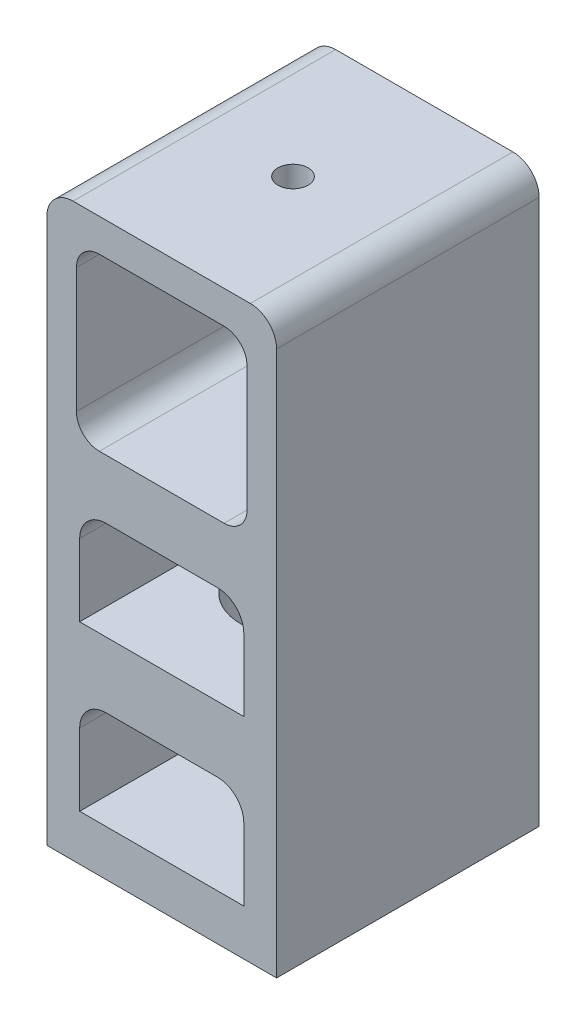
from build123d import *

# Parameters (mm, degrees)
SKETCH1_W           = 35
SKETCH1_H           = 35
SKETCH1_W_2         = 26
SKETCH1_H_2         = 26
SKETCH1_H_3         = 30
SKETCH1_W_3         = 25
SKETCH1_H_4         = 15
BOSS_EXTRUDE2_DEPTH = 40
FILLET3_R           = 3.5
FILLET4_R           = 4
SKETCH6_R           = 2.3
CUT_EXTRUDE5_DEPTH  = 5
BOSS_EXTRUDE3_DEPTH = 40
SKETCH7_R           = 8
CUT_EXTRUDE8_DEPTH  = 10
SKETCH11_R          = 6.25
CUT_EXTRUDE9_DEPTH  = 4
SKETCH12_R          = 2.75
CUT_EXTRUDE10_DEPTH = 97.046863561
FILLET5_R           = 4


with BuildPart() as part:
    # Sketch1 → Boss-Extrude2 (new body)
    # profile 1 of 2: a face of its own
    with BuildSketch(Plane.XY):
        with Locations((17.5, 17.5)):
            Rectangle(SKETCH1_W, SKETCH1_H)
        with Locations((17.5, 17)):
            Rectangle(SKETCH1_W_2, SKETCH1_H_2, mode=Mode.SUBTRACT)
    # profile 2 of 2: a face of its own
    with BuildSketch(Plane.XY):
        with Locations((17.5, -15)):
            Rectangle(SKETCH1_W, SKETCH1_H_3)
        with Locations((17.5, -12.5)):
            Rectangle(SKETCH1_W_3, SKETCH1_H_4, mode=Mode.SUBTRACT)
    extrude(amount=BOSS_EXTRUDE2_DEPTH)

    # Fillet3
    fillet3_edges = [part.edges().sort_by_distance(p)[0] for p in [
        (4.5, 30, 20),
        (4.5, 4, 20),
        (30.5, 4, 20),
        (30.5, 30, 20),
    ]]
    fillet(fillet3_edges, radius=FILLET3_R)

    # Fillet4
    fillet4_edges = [part.edges().sort_by_distance(p)[0] for p in [
        (0, 35, 20),
        (35, 35, 20),
    ]]
    fillet(fillet4_edges, radius=FILLET4_R)

    # Sketch6 → Cut-Extrude5 (cut)
    with BuildSketch(Plane(origin=(0, 35, 0), x_dir=(1, 0, 0), z_dir=(0, 1, 0))):
        with Locations(Location((17.5, -20, 0), (0, 0, 270))):
            Circle(SKETCH6_R)
    extrude(amount=-CUT_EXTRUDE5_DEPTH, mode=Mode.SUBTRACT)

    # Sketch9 → Boss-Extrude3 (add)
    with BuildSketch(Plane.XY.offset(40)):
        Polygon((5, -30), (0, -30), (0, -52), (35, -52), (35, -30), (30, -30), (30, -45), (5, -45), align=None)
    extrude(amount=-BOSS_EXTRUDE3_DEPTH)

    # Sketch7 → Cut-Extrude8 (cut)
    with BuildSketch(Plane(origin=(0, -20, 0), x_dir=(1, 0, 0), z_dir=(0, 1, 0))):
        with Locations(Location((17.5, -20, 0), (0, 0, 180))):
            Circle(SKETCH7_R)
    extrude(amount=-CUT_EXTRUDE8_DEPTH, mode=Mode.SUBTRACT)

    # Sketch11 → Cut-Extrude9 (cut)
    with BuildSketch(Plane(origin=(0, -45, 0), x_dir=(1, 0, 0), z_dir=(0, 1, 0))):
        with Locations(Location((17.5, -20, 0), (0, 0, 270))):
            Circle(SKETCH11_R)
    extrude(amount=-CUT_EXTRUDE9_DEPTH, mode=Mode.SUBTRACT)

    # Sketch12 → Cut-Extrude10 (cut, through all)
    with BuildSketch(Plane(origin=(0, -45, 0), x_dir=(1, 0, 0), z_dir=(0, 1, 0))):
        with Locations(Location((17.5, -20, 0), (0, 0, 270))):
            Circle(SKETCH12_R)
    extrude(amount=-CUT_EXTRUDE10_DEPTH, mode=Mode.SUBTRACT)

    # Fillet5
    fillet5_edges = [part.edges().sort_by_distance(p)[0] for p in [
        (30, -5, 20),
        (5, -5, 20),
        (30, -30, 20),
        (5, -30, 20),
    ]]
    fillet(fillet5_edges, radius=FILLET5_R)


solid = part.part
